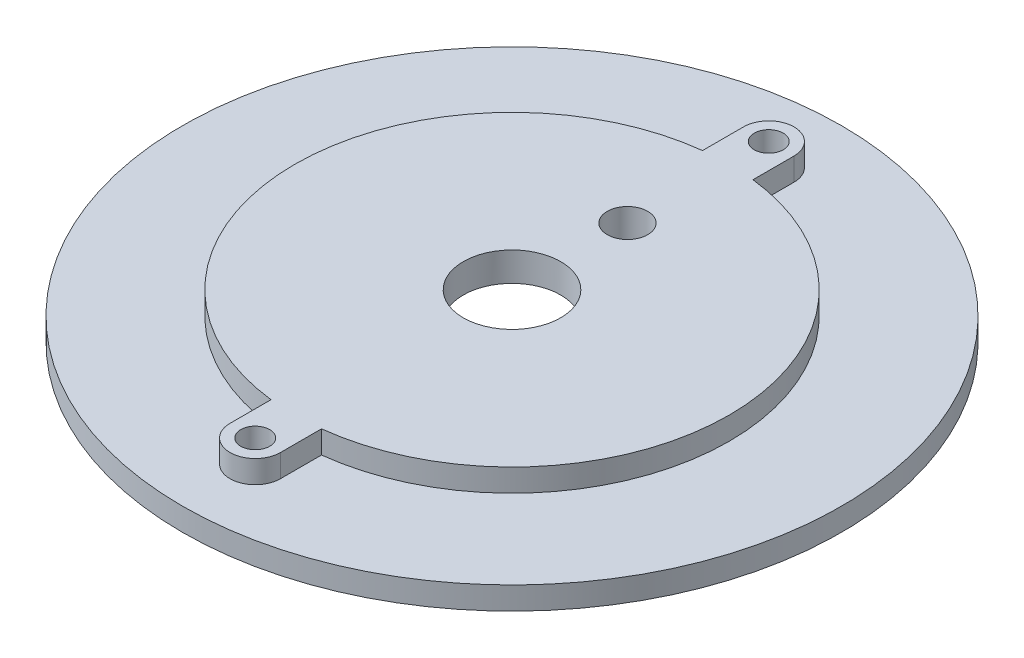
from build123d import *

# Parameters (mm, degrees)
BOSS_EXTRUDE1_DEPTH = 1.96
SKETCH2_R           = 18.76
BOSS_EXTRUDE2_DEPTH = 1.96
SKETCH3_R           = 28.461143805
BOSS_EXTRUDE3_DEPTH = 1.96
CUT_EXTRUDE1_REACH  = 42.441
SKETCH4_R           = 1.25
CUT_EXTRUDE2_REACH  = 42.441
SKETCH5_R           = 4.205
SKETCH5_R_2         = 1.75
SKETCH6_R           = 6.75
CUT_EXTRUDE3_DEPTH  = 1.42


with BuildPart() as part:
    # Sketch1 → Boss-Extrude1 (new body)
    with BuildSketch(Plane(origin=(0, 0, 0), x_dir=(1, 0, 0), z_dir=(0, 1, 0))):
        with BuildLine():
            Line((-2.18, 22.175), (-2.18, -22.175))
            ThreePointArc((-2.18, -22.175), (0, -24.355), (2.18, -22.175))
            Line((2.18, -22.175), (2.18, 22.175))
            ThreePointArc((2.18, 22.175), (0, 24.355), (-2.18, 22.175))
        make_face()
    extrude(amount=BOSS_EXTRUDE1_DEPTH)

    # Sketch2 → Boss-Extrude2 (add)
    with BuildSketch(Plane.XZ):
        Circle(SKETCH2_R)
    extrude(amount=-BOSS_EXTRUDE2_DEPTH)

    # Sketch3 → Boss-Extrude3 (add)
    with BuildSketch(Plane.XZ):
        with Locations(Location((0, 0, 0), (0, 0, 270))):
            Circle(SKETCH3_R)
    extrude(amount=BOSS_EXTRUDE3_DEPTH)

    # Sketch4 → Cut-Extrude1 (cut, up to next)
    with BuildSketch(Plane(origin=(0, 1.96, 0), x_dir=(1, 0, 0), z_dir=(0, 1, 0)), mode=Mode.PRIVATE) as cut_extrude1_sk1:
        with Locations(Location((0, 22.175, 0), (0, 0, 270))):
            Circle(SKETCH4_R)
    cut_extrude1_tool1 = extrude(cut_extrude1_sk1.sketch, amount=-CUT_EXTRUDE1_REACH, mode=Mode.PRIVATE) & part.part
    # Sketch4 → Cut-Extrude1 (cut, up to next)
    with BuildSketch(Plane(origin=(0, 1.96, 0), x_dir=(1, 0, 0), z_dir=(0, 1, 0)), mode=Mode.PRIVATE) as cut_extrude1_sk2:
        with Locations(Location((0, -22.175, 0), (0, 0, 270))):
            Circle(SKETCH4_R)
    cut_extrude1_tool2 = extrude(cut_extrude1_sk2.sketch, amount=-CUT_EXTRUDE1_REACH, mode=Mode.PRIVATE) & part.part
    add(cut_extrude1_tool1.solids().sort_by_distance((0, 1.96, -22.175))[0], mode=Mode.SUBTRACT)
    add(cut_extrude1_tool2.solids().sort_by_distance((0, 1.96, 22.175))[0], mode=Mode.SUBTRACT)

    # Sketch5 → Cut-Extrude2 (cut, up to next)
    with BuildSketch(Plane(origin=(0, 1.96, 0), x_dir=(1, 0, 0), z_dir=(0, 1, 0)), mode=Mode.PRIVATE) as cut_extrude2_sk1:
        with Locations(Location((0, 0, 0), (0, 0, 270))):
            Circle(SKETCH5_R)
    cut_extrude2_tool1 = extrude(cut_extrude2_sk1.sketch, amount=-CUT_EXTRUDE2_REACH, mode=Mode.PRIVATE) & part.part
    # Sketch5 → Cut-Extrude2 (cut, up to next)
    with BuildSketch(Plane(origin=(0, 1.96, 0), x_dir=(1, 0, 0), z_dir=(0, 1, 0)), mode=Mode.PRIVATE) as cut_extrude2_sk2:
        with Locations(Location((0, 9.975, 0), (0, 0, 270))):
            Circle(SKETCH5_R_2)
    cut_extrude2_tool2 = extrude(cut_extrude2_sk2.sketch, amount=-CUT_EXTRUDE2_REACH, mode=Mode.PRIVATE) & part.part
    add(cut_extrude2_tool1.solids().sort_by_distance((0, 1.96, 0))[0], mode=Mode.SUBTRACT)
    add(cut_extrude2_tool2.solids().sort_by_distance((0, 1.96, -9.975))[0], mode=Mode.SUBTRACT)

    # Sketch6 → Cut-Extrude3 (cut)
    with BuildSketch(Plane.XZ.offset(1.96)):
        with Locations(Location((0, 0, 0), (0, 0, 270))):
            Circle(SKETCH6_R)
    extrude(amount=-CUT_EXTRUDE3_DEPTH, mode=Mode.SUBTRACT)


solid = part.part
